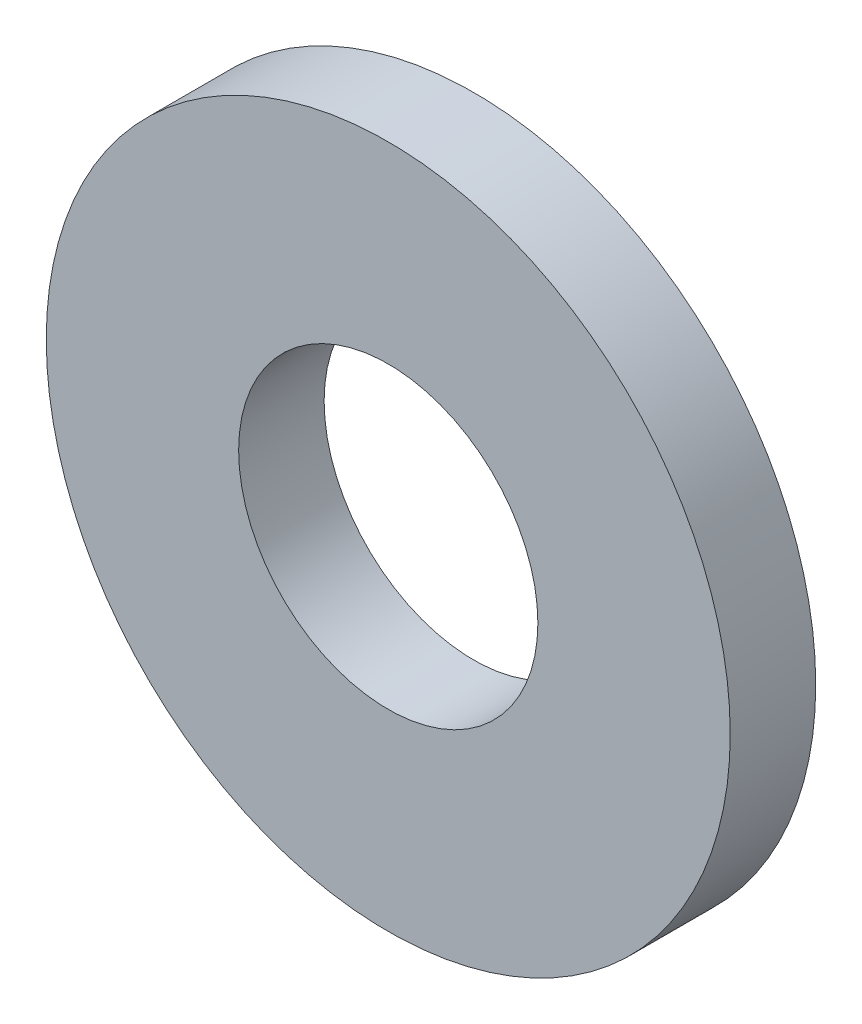
from build123d import *

# Parameters (mm, degrees)
ESBO_O1_R                = 8
ESBO_O1_R_2              = 3.5
RESSALTO_EXTRUS_O1_DEPTH = 2


with BuildPart() as part:
    # Esboço1 → Ressalto-extrusão1 (new body)
    with BuildSketch(Plane.XY):
        Circle(ESBO_O1_R)
        Circle(ESBO_O1_R_2, mode=Mode.SUBTRACT)
    extrude(amount=RESSALTO_EXTRUS_O1_DEPTH)


solid = part.part
